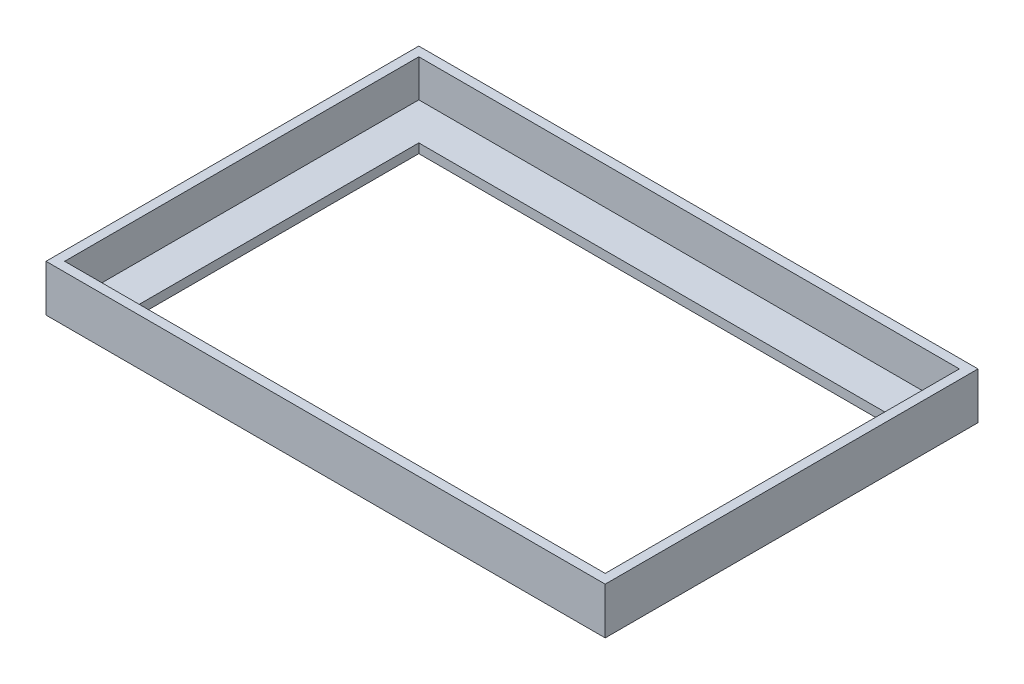
from build123d import *

# Parameters (mm, degrees)
SKETCH3_W               = 60
SKETCH3_H               = 40
BOSS_EXTRUDE1_DEPTH     = 5
CUT_EXTRUDE1_DEPTH      = 73.284161474
CUT_EXTRUDE1_DEPTH_BACK = 73.284161474
SKETCH6_W               = 58
SKETCH6_H               = 38
SKETCH7_W               = 60
SKETCH7_H               = 40
BOSS_EXTRUDE2_DEPTH     = 1
CUT_EXTRUDE2_DEPTH      = 73.284161474
CUT_EXTRUDE2_DEPTH_BACK = 73.284161474
SKETCH8_W               = 50
SKETCH8_H               = 30


with BuildPart() as part:
    # Sketch3 → Boss-Extrude1 (new body)
    with BuildSketch(Plane(origin=(0, 0, 0), x_dir=(1, 0, 0), z_dir=(0, 1, 0))):
        with Locations((30, 20)):
            Rectangle(SKETCH3_W, SKETCH3_H)
    extrude(amount=BOSS_EXTRUDE1_DEPTH)

    # Sketch6 → Cut-Extrude1 (cut, two sides: drawn at the far end of the back side and taken through both)
    with BuildSketch(Plane(origin=(0, 0, 0), x_dir=(1, 0, 0), z_dir=(0, 1, 0)).offset(-CUT_EXTRUDE1_DEPTH_BACK)):
        with Locations((30, 20)):
            Rectangle(SKETCH6_W, SKETCH6_H)
    extrude(amount=CUT_EXTRUDE1_DEPTH + CUT_EXTRUDE1_DEPTH_BACK, mode=Mode.SUBTRACT)

    # Sketch7 → Boss-Extrude2 (add)
    with BuildSketch(Plane(origin=(0, 0, 0), x_dir=(1, 0, 0), z_dir=(0, 1, 0))):
        with Locations((30, 20)):
            Rectangle(SKETCH7_W, SKETCH7_H)
    extrude(amount=BOSS_EXTRUDE2_DEPTH)

    # Sketch8 → Cut-Extrude2 (cut, two sides: drawn at the far end of the back side and taken through both)
    with BuildSketch(Plane.XZ.offset(-CUT_EXTRUDE2_DEPTH_BACK)):
        with Locations((30, -20)):
            Rectangle(SKETCH8_W, SKETCH8_H)
    extrude(amount=CUT_EXTRUDE2_DEPTH + CUT_EXTRUDE2_DEPTH_BACK, mode=Mode.SUBTRACT)


solid = part.part
